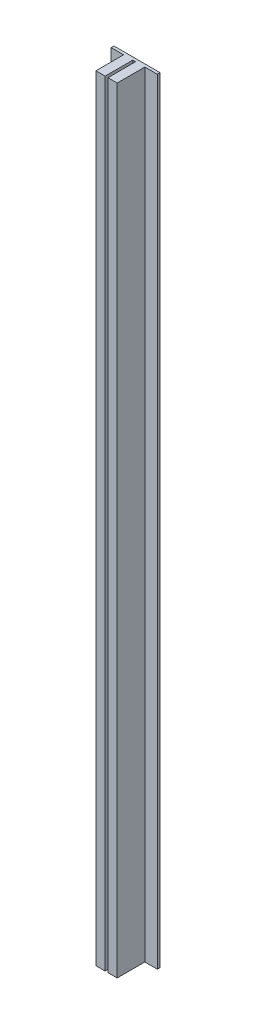
from build123d import *

# Parameters (mm, degrees)
SKETCH1_W           = 50
SKETCH1_H           = 840
BOSS_EXTRUDE1_DEPTH = 3
SKETCH2_W           = 23
SKETCH2_H           = 840
BOSS_EXTRUDE2_DEPTH = 30
SKETCH3_W           = 3
SKETCH3_H           = 840
CUT_EXTRUDE1_DEPTH  = 30


with BuildPart() as part:
    # Sketch1 → Boss-Extrude1 (new body)
    with BuildSketch(Plane.XY):
        with Locations((25, -420)):
            Rectangle(SKETCH1_W, SKETCH1_H)
    extrude(amount=BOSS_EXTRUDE1_DEPTH)

    # Sketch2 → Boss-Extrude2 (add)
    with BuildSketch(Plane.XY.offset(3)):
        with Locations((25, -420)):
            Rectangle(SKETCH2_W, SKETCH2_H)
    extrude(amount=BOSS_EXTRUDE2_DEPTH)

    # Sketch3 → Cut-Extrude1 (cut)
    with BuildSketch(Plane.XY.offset(33)):
        with Locations((25, -420)):
            Rectangle(SKETCH3_W, SKETCH3_H)
    extrude(amount=-CUT_EXTRUDE1_DEPTH, mode=Mode.SUBTRACT)


solid = part.part
